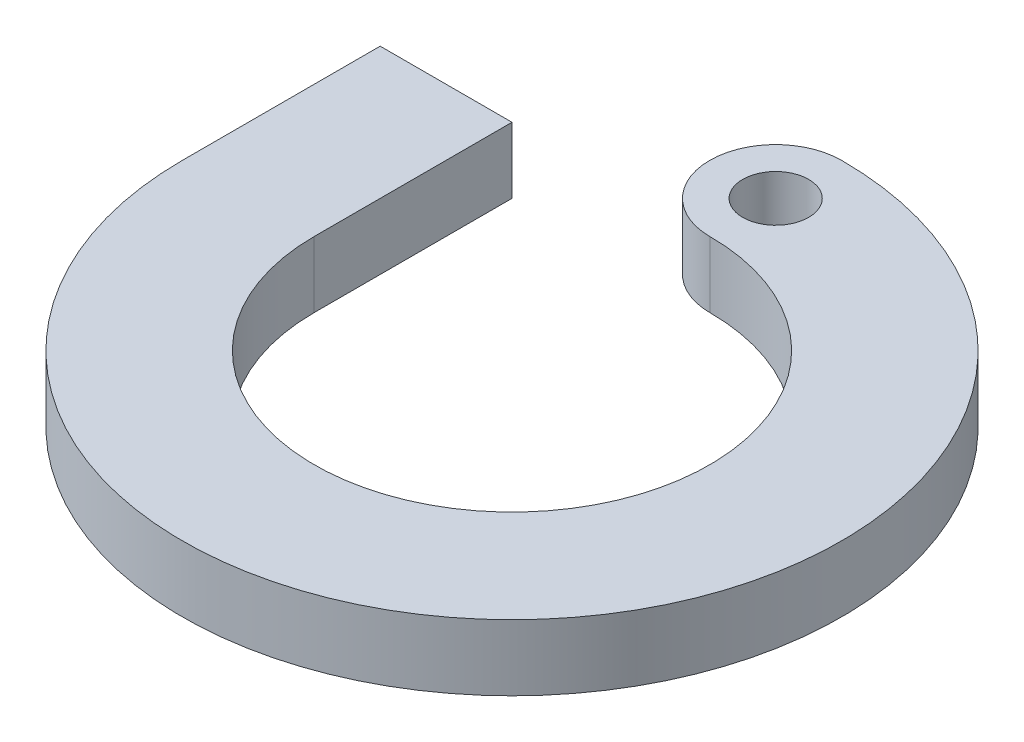
from build123d import *

# Parameters (mm, degrees)
SKETCH_1_R      = 5
EXTRUDE_1_DEPTH = 10


with BuildPart() as part:
    # 草图1 → 凸台-拉伸1 (new body)
    with BuildSketch(Plane(origin=(0, 0, 0), x_dir=(1, 0, 0), z_dir=(0, 1, 0))):
        with BuildLine():
            Line((-50, 0), (-50, 30))
            Line((-50, 30), (-30, 30))
            Line((-30, 30), (-30, 0))
            ThreePointArc((-30, 0), (21.213203436, -21.213203436), (0, 30))
            ThreePointArc((0, 30), (-10, 40), (0, 50))
            ThreePointArc((0, 50), (35.355339059, -35.355339059), (-50, 0))
        make_face()
        with Locations(Location((0, 40, 0), (0, 0, 270))):
            Circle(SKETCH_1_R, mode=Mode.SUBTRACT)
    extrude(amount=EXTRUDE_1_DEPTH)


solid = part.part
